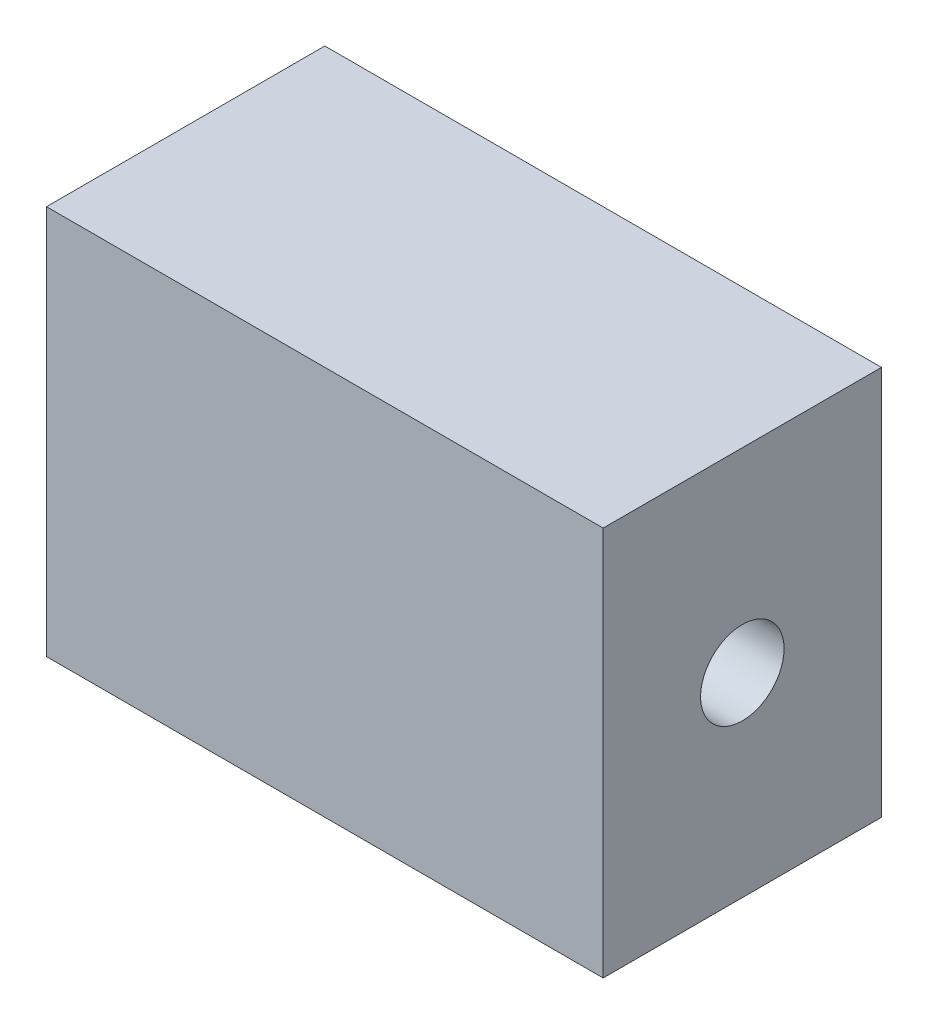
from build123d import *

# Parameters (mm, degrees)
SKETCH1_W           = 100
SKETCH1_H           = 70
BOSS_EXTRUDE1_DEPTH = 50
SKETCH2_R           = 7.5
CUT_EXTRUDE1_DEPTH  = 100
SKETCH3_W           = 80
SKETCH3_H           = 50
CUT_EXTRUDE2_DEPTH  = 10


with BuildPart() as part:
    # Sketch1 → Boss-Extrude1 (new body)
    with BuildSketch(Plane.XY):
        with Locations((50, 35)):
            Rectangle(SKETCH1_W, SKETCH1_H)
    extrude(amount=BOSS_EXTRUDE1_DEPTH)

    # Sketch2 → Cut-Extrude1 (cut)
    with BuildSketch(Plane(origin=(100, 0, 0), x_dir=(0, 0, -1), z_dir=(1, 0, 0))):
        with Locations((-25, 35)):
            Circle(SKETCH2_R)
    extrude(amount=-CUT_EXTRUDE1_DEPTH, mode=Mode.SUBTRACT)

    # Sketch3 → Cut-Extrude2 (cut)
    with BuildSketch(Plane(origin=(0, 0, 0), x_dir=(-1, 0, 0), z_dir=(0, 0, -1))):
        with Locations((-50, 35)):
            Rectangle(SKETCH3_W, SKETCH3_H)
    extrude(amount=-CUT_EXTRUDE2_DEPTH, mode=Mode.SUBTRACT)


solid = part.part
